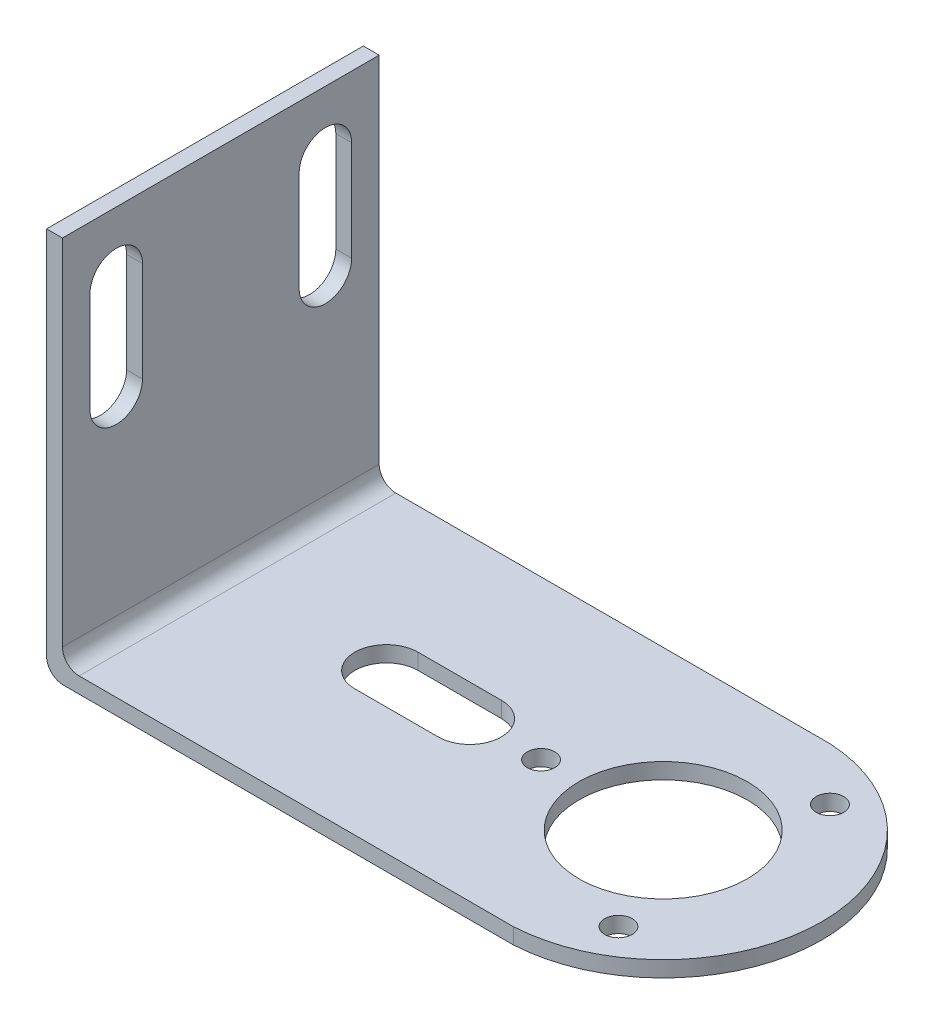
from build123d import *

# Parameters (mm, degrees)
SKETCH1_R           = 1.65
SKETCH1_R_2         = 10.1
BOSS_EXTRUDE1_DEPTH = 1.9
SKETCH2_W           = 1.9
SKETCH2_H           = 38
BOSS_EXTRUDE2_DEPTH = 44.5
CUT_EXTRUDE1_REACH  = 89.82
FILLET1_R           = 2


with BuildPart() as part:
    # Sketch1 → Boss-Extrude1 (new body)
    with BuildSketch(Plane(origin=(0, 0, 0), x_dir=(1, 0, 0), z_dir=(0, 1, 0))):
        with BuildLine():
            Line((-37, 19), (-37, -19))
            Line((-37, -19), (19, -19))
            ThreePointArc((19, -19), (31.785488519, -13.086252381), (37, -1.44e-07))
            ThreePointArc((37, -1.44e-07), (31.785488618, 13.086252276), (19, 19))
            Line((19, 19), (-37, 19))
        make_face()
        with Locations(Location((25.297222222, -12.687272165, 0), (0, 0, 90))):
            Circle(SKETCH1_R, mode=Mode.SUBTRACT)
        with BuildLine():
            ThreePointArc((-15.227777778, -3.8), (-19.027777778, 0), (-15.227777778, 3.8))
            Line((-15.227777778, 3.8), (-5.227777778, 3.8))
            ThreePointArc((-5.227777778, 3.8), (-1.427777778, 0), (-5.227777778, -3.8))
            Line((-5.227777778, -3.8), (-15.227777778, -3.8))
        make_face(mode=Mode.SUBTRACT)
        with Locations(Location((3.322222222, 0, 0), (0, 0, 90))):
            Circle(SKETCH1_R, mode=Mode.SUBTRACT)
        with Locations(Location((17.972222222, 0, 0), (0, 0, 90))):
            Circle(SKETCH1_R_2, mode=Mode.SUBTRACT)
        with Locations(Location((25.297222222, 12.687272165, 0), (0, 0, 90))):
            Circle(SKETCH1_R, mode=Mode.SUBTRACT)
    extrude(amount=BOSS_EXTRUDE1_DEPTH)

    # Sketch2 → Boss-Extrude2 (add)
    with BuildSketch(Plane(origin=(0, 1.9, 0), x_dir=(1, 0, 0), z_dir=(0, 1, 0))):
        with Locations((-36.05, 0)):
            Rectangle(SKETCH2_W, SKETCH2_H)
    extrude(amount=BOSS_EXTRUDE2_DEPTH)

    # Sketch3 → Cut-Extrude1 (cut, up to next)
    with BuildSketch(Plane(origin=(-35.1, 0, 0), x_dir=(0, 0, -1), z_dir=(1, 0, 0)), mode=Mode.PRIVATE) as cut_extrude1_sk1:
        with BuildLine():
            ThreePointArc((-9.4, 38.95), (-12.55, 42.1), (-15.7, 38.95))
            Line((-15.7, 38.95), (-9.4, 38.95))
        make_face()
    cut_extrude1_tool1 = extrude(cut_extrude1_sk1.sketch, amount=-CUT_EXTRUDE1_REACH, mode=Mode.PRIVATE) & part.part
    # Sketch3 → Cut-Extrude1 (cut, up to next)
    with BuildSketch(Plane(origin=(-35.1, 0, 0), x_dir=(0, 0, -1), z_dir=(1, 0, 0)), mode=Mode.PRIVATE) as cut_extrude1_sk2:
        with BuildLine():
            Line((-9.4, 38.95), (-15.7, 38.95))
            ThreePointArc((-15.7, 38.95), (-12.55, 35.8), (-9.4, 38.95))
        make_face()
    cut_extrude1_tool2 = extrude(cut_extrude1_sk2.sketch, amount=-CUT_EXTRUDE1_REACH, mode=Mode.PRIVATE) & part.part
    # Sketch3 → Cut-Extrude1 (cut, up to next)
    with BuildSketch(Plane(origin=(-35.1, 0, 0), x_dir=(0, 0, -1), z_dir=(1, 0, 0)), mode=Mode.PRIVATE) as cut_extrude1_sk3:
        with BuildLine():
            ThreePointArc((-9.4, 38.95), (-12.55, 42.1), (-15.7, 38.95))
            Line((-15.7, 38.95), (-9.4, 38.95))
        make_face()
    cut_extrude1_tool3 = extrude(cut_extrude1_sk3.sketch, amount=-CUT_EXTRUDE1_REACH, mode=Mode.PRIVATE) & part.part
    # Sketch3 → Cut-Extrude1 (cut, up to next)
    with BuildSketch(Plane(origin=(-35.1, 0, 0), x_dir=(0, 0, -1), z_dir=(1, 0, 0)), mode=Mode.PRIVATE) as cut_extrude1_sk4:
        with BuildLine():
            Line((-9.4, 38.95), (-15.7, 38.95))
            ThreePointArc((-15.7, 38.95), (-12.55, 35.8), (-9.4, 38.95))
        make_face()
    cut_extrude1_tool4 = extrude(cut_extrude1_sk4.sketch, amount=-CUT_EXTRUDE1_REACH, mode=Mode.PRIVATE) & part.part
    # Sketch3 → Cut-Extrude1 (cut, up to next)
    with BuildSketch(Plane(origin=(-35.1, 0, 0), x_dir=(0, 0, -1), z_dir=(1, 0, 0)), mode=Mode.PRIVATE) as cut_extrude1_sk5:
        with BuildLine():
            Line((-15.7, 38.95), (-15.7, 26.95))
            ThreePointArc((-15.7, 26.95), (-12.55, 30.1), (-9.4, 26.95))
            Line((-9.4, 26.95), (-9.4, 38.95))
            ThreePointArc((-9.4, 38.95), (-12.55, 35.8), (-15.7, 38.95))
        make_face()
    cut_extrude1_tool5 = extrude(cut_extrude1_sk5.sketch, amount=-CUT_EXTRUDE1_REACH, mode=Mode.PRIVATE) & part.part
    # Sketch3 → Cut-Extrude1 (cut, up to next)
    with BuildSketch(Plane(origin=(-35.1, 0, 0), x_dir=(0, 0, -1), z_dir=(1, 0, 0)), mode=Mode.PRIVATE) as cut_extrude1_sk6:
        with BuildLine():
            ThreePointArc((-9.4, 26.95), (-12.55, 30.1), (-15.7, 26.95))
            Line((-15.7, 26.95), (-9.4, 26.95))
        make_face()
    cut_extrude1_tool6 = extrude(cut_extrude1_sk6.sketch, amount=-CUT_EXTRUDE1_REACH, mode=Mode.PRIVATE) & part.part
    # Sketch3 → Cut-Extrude1 (cut, up to next)
    with BuildSketch(Plane(origin=(-35.1, 0, 0), x_dir=(0, 0, -1), z_dir=(1, 0, 0)), mode=Mode.PRIVATE) as cut_extrude1_sk7:
        with BuildLine():
            Line((-9.4, 26.95), (-15.7, 26.95))
            ThreePointArc((-15.7, 26.95), (-12.55, 23.8), (-9.4, 26.95))
        make_face()
    cut_extrude1_tool7 = extrude(cut_extrude1_sk7.sketch, amount=-CUT_EXTRUDE1_REACH, mode=Mode.PRIVATE) & part.part
    # Sketch3 → Cut-Extrude1 (cut, up to next)
    with BuildSketch(Plane(origin=(-35.1, 0, 0), x_dir=(0, 0, -1), z_dir=(1, 0, 0)), mode=Mode.PRIVATE) as cut_extrude1_sk8:
        with BuildLine():
            Line((9.4, 38.95), (9.4, 26.95))
            ThreePointArc((9.4, 26.95), (12.55, 30.1), (15.7, 26.95))
            Line((15.7, 26.95), (15.7, 38.95))
            ThreePointArc((15.7, 38.95), (12.55, 35.8), (9.4, 38.95))
        make_face()
    cut_extrude1_tool8 = extrude(cut_extrude1_sk8.sketch, amount=-CUT_EXTRUDE1_REACH, mode=Mode.PRIVATE) & part.part
    # Sketch3 → Cut-Extrude1 (cut, up to next)
    with BuildSketch(Plane(origin=(-35.1, 0, 0), x_dir=(0, 0, -1), z_dir=(1, 0, 0)), mode=Mode.PRIVATE) as cut_extrude1_sk9:
        with BuildLine():
            ThreePointArc((15.7, 38.95), (12.55, 42.1), (9.4, 38.95))
            Line((9.4, 38.95), (15.7, 38.95))
        make_face()
    cut_extrude1_tool9 = extrude(cut_extrude1_sk9.sketch, amount=-CUT_EXTRUDE1_REACH, mode=Mode.PRIVATE) & part.part
    # Sketch3 → Cut-Extrude1 (cut, up to next)
    with BuildSketch(Plane(origin=(-35.1, 0, 0), x_dir=(0, 0, -1), z_dir=(1, 0, 0)), mode=Mode.PRIVATE) as cut_extrude1_sk10:
        with BuildLine():
            Line((15.7, 38.95), (9.4, 38.95))
            ThreePointArc((9.4, 38.95), (12.55, 35.8), (15.7, 38.95))
        make_face()
    cut_extrude1_tool10 = extrude(cut_extrude1_sk10.sketch, amount=-CUT_EXTRUDE1_REACH, mode=Mode.PRIVATE) & part.part
    # Sketch3 → Cut-Extrude1 (cut, up to next)
    with BuildSketch(Plane(origin=(-35.1, 0, 0), x_dir=(0, 0, -1), z_dir=(1, 0, 0)), mode=Mode.PRIVATE) as cut_extrude1_sk11:
        with BuildLine():
            ThreePointArc((15.7, 38.95), (12.55, 42.1), (9.4, 38.95))
            Line((9.4, 38.95), (15.7, 38.95))
        make_face()
    cut_extrude1_tool11 = extrude(cut_extrude1_sk11.sketch, amount=-CUT_EXTRUDE1_REACH, mode=Mode.PRIVATE) & part.part
    # Sketch3 → Cut-Extrude1 (cut, up to next)
    with BuildSketch(Plane(origin=(-35.1, 0, 0), x_dir=(0, 0, -1), z_dir=(1, 0, 0)), mode=Mode.PRIVATE) as cut_extrude1_sk12:
        with BuildLine():
            Line((15.7, 38.95), (9.4, 38.95))
            ThreePointArc((9.4, 38.95), (12.55, 35.8), (15.7, 38.95))
        make_face()
    cut_extrude1_tool12 = extrude(cut_extrude1_sk12.sketch, amount=-CUT_EXTRUDE1_REACH, mode=Mode.PRIVATE) & part.part
    # Sketch3 → Cut-Extrude1 (cut, up to next)
    with BuildSketch(Plane(origin=(-35.1, 0, 0), x_dir=(0, 0, -1), z_dir=(1, 0, 0)), mode=Mode.PRIVATE) as cut_extrude1_sk13:
        with BuildLine():
            ThreePointArc((15.7, 26.95), (12.55, 30.1), (9.4, 26.95))
            Line((9.4, 26.95), (15.7, 26.95))
        make_face()
    cut_extrude1_tool13 = extrude(cut_extrude1_sk13.sketch, amount=-CUT_EXTRUDE1_REACH, mode=Mode.PRIVATE) & part.part
    # Sketch3 → Cut-Extrude1 (cut, up to next)
    with BuildSketch(Plane(origin=(-35.1, 0, 0), x_dir=(0, 0, -1), z_dir=(1, 0, 0)), mode=Mode.PRIVATE) as cut_extrude1_sk14:
        with BuildLine():
            Line((15.7, 26.95), (9.4, 26.95))
            ThreePointArc((9.4, 26.95), (12.55, 23.8), (15.7, 26.95))
        make_face()
    cut_extrude1_tool14 = extrude(cut_extrude1_sk14.sketch, amount=-CUT_EXTRUDE1_REACH, mode=Mode.PRIVATE) & part.part
    # Sketch3 → Cut-Extrude1 (cut, up to next)
    with BuildSketch(Plane(origin=(-35.1, 0, 0), x_dir=(0, 0, -1), z_dir=(1, 0, 0)), mode=Mode.PRIVATE) as cut_extrude1_sk15:
        with BuildLine():
            ThreePointArc((15.7, 26.95), (12.55, 30.1), (9.4, 26.95))
            Line((9.4, 26.95), (15.7, 26.95))
        make_face()
    cut_extrude1_tool15 = extrude(cut_extrude1_sk15.sketch, amount=-CUT_EXTRUDE1_REACH, mode=Mode.PRIVATE) & part.part
    # Sketch3 → Cut-Extrude1 (cut, up to next)
    with BuildSketch(Plane(origin=(-35.1, 0, 0), x_dir=(0, 0, -1), z_dir=(1, 0, 0)), mode=Mode.PRIVATE) as cut_extrude1_sk16:
        with BuildLine():
            Line((15.7, 26.95), (9.4, 26.95))
            ThreePointArc((9.4, 26.95), (12.55, 23.8), (15.7, 26.95))
        make_face()
    cut_extrude1_tool16 = extrude(cut_extrude1_sk16.sketch, amount=-CUT_EXTRUDE1_REACH, mode=Mode.PRIVATE) & part.part
    # Sketch3 → Cut-Extrude1 (cut, up to next)
    with BuildSketch(Plane(origin=(-35.1, 0, 0), x_dir=(0, 0, -1), z_dir=(1, 0, 0)), mode=Mode.PRIVATE) as cut_extrude1_sk17:
        with BuildLine():
            ThreePointArc((-9.4, 26.95), (-12.55, 30.1), (-15.7, 26.95))
            Line((-15.7, 26.95), (-9.4, 26.95))
        make_face()
    cut_extrude1_tool17 = extrude(cut_extrude1_sk17.sketch, amount=-CUT_EXTRUDE1_REACH, mode=Mode.PRIVATE) & part.part
    # Sketch3 → Cut-Extrude1 (cut, up to next)
    with BuildSketch(Plane(origin=(-35.1, 0, 0), x_dir=(0, 0, -1), z_dir=(1, 0, 0)), mode=Mode.PRIVATE) as cut_extrude1_sk18:
        with BuildLine():
            Line((-9.4, 26.95), (-15.7, 26.95))
            ThreePointArc((-15.7, 26.95), (-12.55, 23.8), (-9.4, 26.95))
        make_face()
    cut_extrude1_tool18 = extrude(cut_extrude1_sk18.sketch, amount=-CUT_EXTRUDE1_REACH, mode=Mode.PRIVATE) & part.part
    add(cut_extrude1_tool1.solids().sort_by_distance((-35.1, 40.286902, 12.55))[0], mode=Mode.SUBTRACT)
    add(cut_extrude1_tool2.solids().sort_by_distance((-35.1, 37.613098, 12.55))[0], mode=Mode.SUBTRACT)
    add(cut_extrude1_tool3.solids().sort_by_distance((-35.1, 40.286902, 12.55))[0], mode=Mode.SUBTRACT)
    add(cut_extrude1_tool4.solids().sort_by_distance((-35.1, 37.613098, 12.55))[0], mode=Mode.SUBTRACT)
    add(cut_extrude1_tool5.solids().sort_by_distance((-35.1, 32.95, 12.55))[0], mode=Mode.SUBTRACT)
    add(cut_extrude1_tool6.solids().sort_by_distance((-35.1, 28.286902, 12.55))[0], mode=Mode.SUBTRACT)
    add(cut_extrude1_tool7.solids().sort_by_distance((-35.1, 25.613098, 12.55))[0], mode=Mode.SUBTRACT)
    add(cut_extrude1_tool8.solids().sort_by_distance((-35.1, 32.95, -12.55))[0], mode=Mode.SUBTRACT)
    add(cut_extrude1_tool9.solids().sort_by_distance((-35.1, 40.286902, -12.55))[0], mode=Mode.SUBTRACT)
    add(cut_extrude1_tool10.solids().sort_by_distance((-35.1, 37.613098, -12.55))[0], mode=Mode.SUBTRACT)
    add(cut_extrude1_tool11.solids().sort_by_distance((-35.1, 40.286902, -12.55))[0], mode=Mode.SUBTRACT)
    add(cut_extrude1_tool12.solids().sort_by_distance((-35.1, 37.613098, -12.55))[0], mode=Mode.SUBTRACT)
    add(cut_extrude1_tool13.solids().sort_by_distance((-35.1, 28.286902, -12.55))[0], mode=Mode.SUBTRACT)
    add(cut_extrude1_tool14.solids().sort_by_distance((-35.1, 25.613098, -12.55))[0], mode=Mode.SUBTRACT)
    add(cut_extrude1_tool15.solids().sort_by_distance((-35.1, 28.286902, -12.55))[0], mode=Mode.SUBTRACT)
    add(cut_extrude1_tool16.solids().sort_by_distance((-35.1, 25.613098, -12.55))[0], mode=Mode.SUBTRACT)
    add(cut_extrude1_tool17.solids().sort_by_distance((-35.1, 28.286902, 12.55))[0], mode=Mode.SUBTRACT)
    add(cut_extrude1_tool18.solids().sort_by_distance((-35.1, 25.613098, 12.55))[0], mode=Mode.SUBTRACT)

    # Fillet1
    fillet1_edges = [part.edges().sort_by_distance(p)[0] for p in [
        (-37, 0, 0),
        (-35.1, 1.9, 0),
    ]]
    fillet(fillet1_edges, radius=FILLET1_R)


solid = part.part
